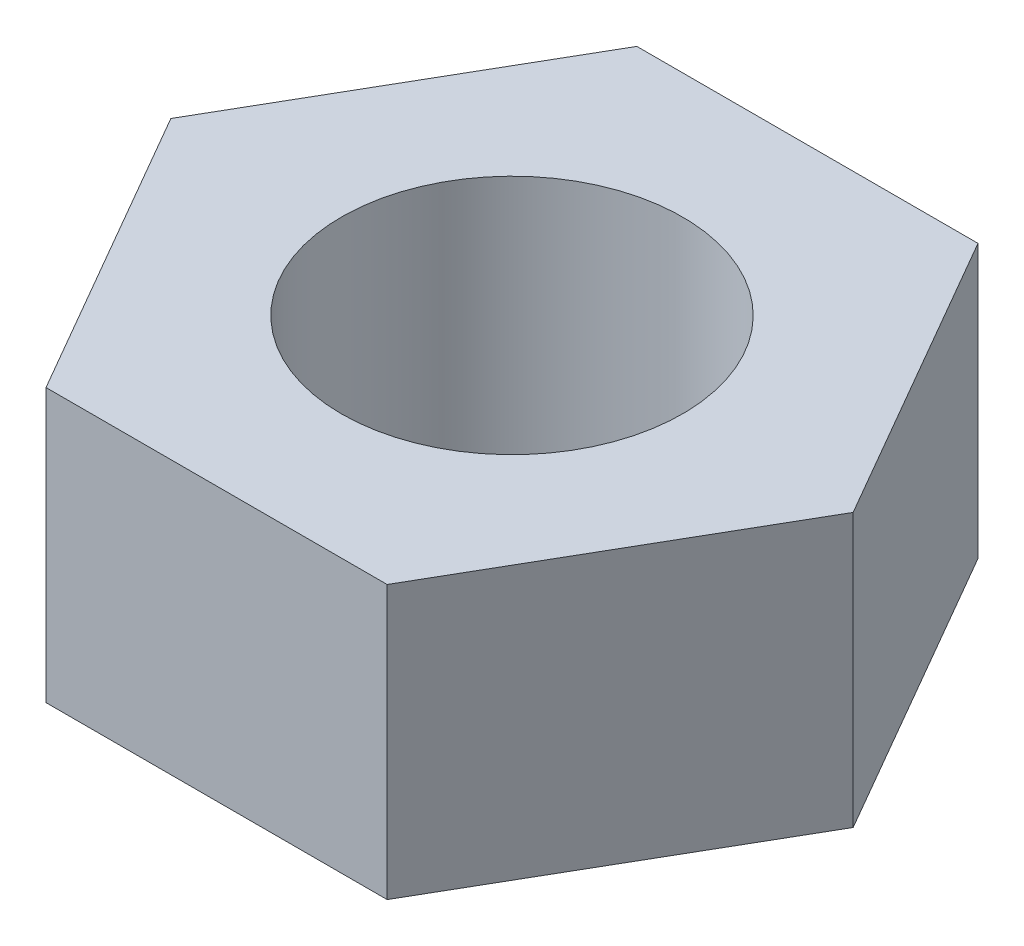
from build123d import *

# Parameters (mm, degrees)
SKETCH_1_R      = 2
EXTRUDE_1_DEPTH = 3.2


with BuildPart() as part:
    # 草图1 → 凸台-拉伸1 (new body)
    with BuildSketch(Plane(origin=(0, 0, 0), x_dir=(1, 0, 0), z_dir=(0, 1, 0))):
        Polygon((4, 0), (2, 3.464101615), (-2, 3.464101615), (-4, 0), (-2, -3.464101615), (2, -3.464101615), align=None)
        with Locations(Location((0, 0, 0), (0, 0, 270))):
            Circle(SKETCH_1_R, mode=Mode.SUBTRACT)
    extrude(amount=EXTRUDE_1_DEPTH)


solid = part.part
